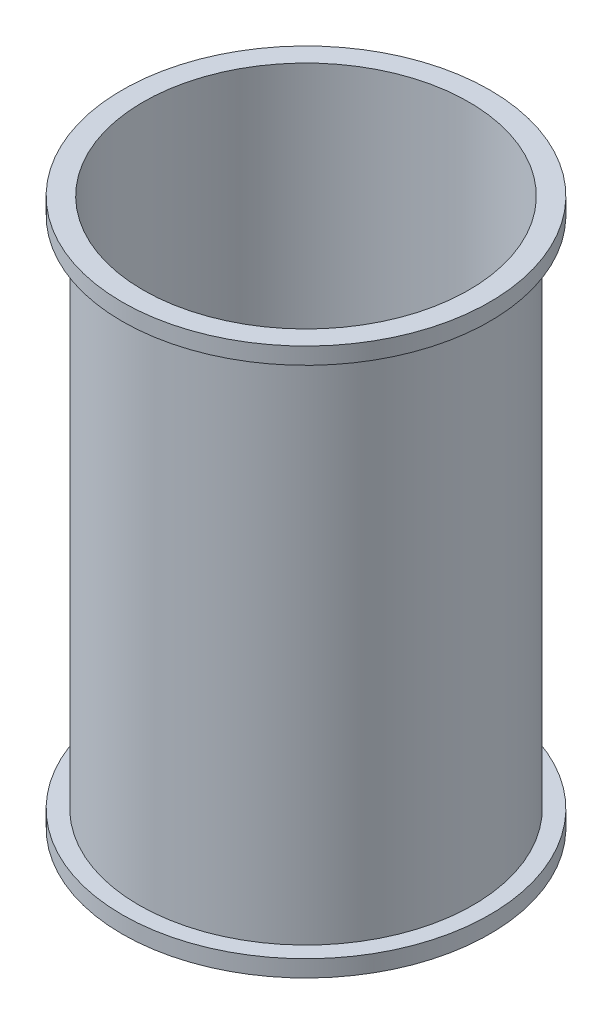
from build123d import *

# Parameters (mm, degrees)
SKETCH1_R           = 127
SKETCH1_R_2         = 123.825
BOSS_EXTRUDE1_DEPTH = 416.052
SKETCH1_3_R         = 139.7
SKETCH1_3_R_2       = 127
BOSS_EXTRUDE2_DEPTH = 12.7
BOSS_EXTRUDE4_START = 403.352
SKETCH1_5_R         = 139.7
SKETCH1_5_R_2       = 127
BOSS_EXTRUDE4_DEPTH = 12.7


with BuildPart() as part:
    # Sketch1 → Boss-Extrude1 (new body)
    with BuildSketch(Plane(origin=(0, 0, 0), x_dir=(1, 0, 0), z_dir=(0, 1, 0))):
        Circle(SKETCH1_R)
        Circle(SKETCH1_R_2, mode=Mode.SUBTRACT)
    extrude(amount=BOSS_EXTRUDE1_DEPTH)

    # Sketch1<3> → Boss-Extrude2 (add)
    with BuildSketch(Plane(origin=(0, 0, 0), x_dir=(1, 0, 0), z_dir=(0, 1, 0))):
        Circle(SKETCH1_3_R)
        Circle(SKETCH1_3_R_2, mode=Mode.SUBTRACT)
    extrude(amount=BOSS_EXTRUDE2_DEPTH)

    # Sketch1<5> → Boss-Extrude4 (add)
    with BuildSketch(Plane(origin=(0, 0, 0), x_dir=(1, 0, 0), z_dir=(0, 1, 0)).offset(BOSS_EXTRUDE4_START)):
        Circle(SKETCH1_5_R)
        Circle(SKETCH1_5_R_2, mode=Mode.SUBTRACT)
    extrude(amount=BOSS_EXTRUDE4_DEPTH)


solid = part.part
